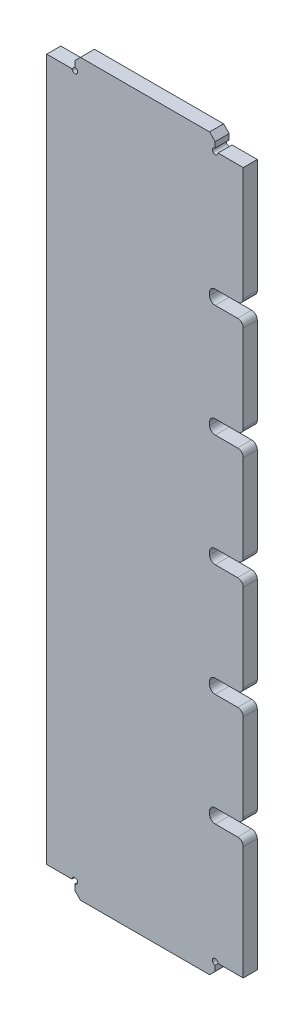
from build123d import *

# Parameters (mm, degrees)
EXTRUDE_1_DEPTH = 2.5
FILLET_1_R      = 2


with BuildPart() as part:
    # 草圖1 → 填料-伸長1 (new, symmetric)
    with BuildSketch(Plane.XY):
        with BuildLine():
            Line((-25, 2), (-23, 0))
            Line((-23, 0), (23, 0))
            Line((23, 0), (25, 2))
            Line((25, 2), (25, 4))
            ThreePointArc((25, 4), (24.292893219, 5.707106781), (26, 5))
            Line((26, 5), (35, 5))
            Line((35, 5), (35, 47.5))
            Line((35, 47.5), (23, 47.5))
            Line((23, 47.5), (23, 52.5))
            Line((23, 52.5), (35, 52.5))
            Line((35, 52.5), (35, 87.5))
            Line((35, 87.5), (23, 87.5))
            Line((23, 87.5), (23, 92.5))
            Line((23, 92.5), (35, 92.5))
            Line((35, 92.5), (35, 127.5))
            Line((35, 127.5), (23, 127.5))
            Line((23, 127.5), (23, 132.5))
            Line((23, 132.5), (35, 132.5))
            Line((35, 132.5), (35, 167.5))
            Line((35, 167.5), (23, 167.5))
            Line((23, 167.5), (23, 172.5))
            Line((23, 172.5), (35, 172.5))
            Line((35, 172.5), (35, 207.5))
            Line((35, 207.5), (23, 207.5))
            Line((23, 207.5), (23, 212.5))
            Line((23, 212.5), (35, 212.5))
            Line((35, 212.5), (35, 255))
            Line((35, 255), (26, 255))
            ThreePointArc((26, 255), (24.292893219, 254.292893219), (25, 256))
            Line((25, 256), (25, 258))
            Line((25, 258), (23, 260))
            Line((23, 260), (-23, 260))
            Line((-23, 260), (-25, 258))
            Line((-25, 258), (-25, 256))
            ThreePointArc((-25, 256), (-24.292893219, 254.292893219), (-26, 255))
            Line((-26, 255), (-35, 255))
            Line((-35, 255), (-35, 5))
            Line((-35, 5), (-26, 5))
            ThreePointArc((-26, 5), (-24.292893219, 5.707106781), (-25, 4))
            Line((-25, 4), (-25, 2))
        make_face()
    extrude(amount=EXTRUDE_1_DEPTH, both=True)

    # 圓角1
    fillet_1_edges = [part.edges().sort_by_distance(p)[0] for p in [
        (35, 47.5, 0),
        (23, 47.5, 0),
        (23, 52.5, 0),
        (35, 52.5, 0),
        (35, 87.5, 0),
        (23, 87.5, 0),
        (23, 92.5, 0),
        (35, 92.5, 0),
        (35, 127.5, 0),
        (23, 127.5, 0),
        (23, 132.5, 0),
        (35, 132.5, 0),
        (35, 167.5, 0),
        (23, 167.5, 0),
        (23, 172.5, 0),
        (35, 172.5, 0),
        (35, 207.5, 0),
        (23, 207.5, 0),
        (23, 212.5, 0),
        (35, 212.5, 0),
    ]]
    fillet(fillet_1_edges, radius=FILLET_1_R)


solid = part.part
